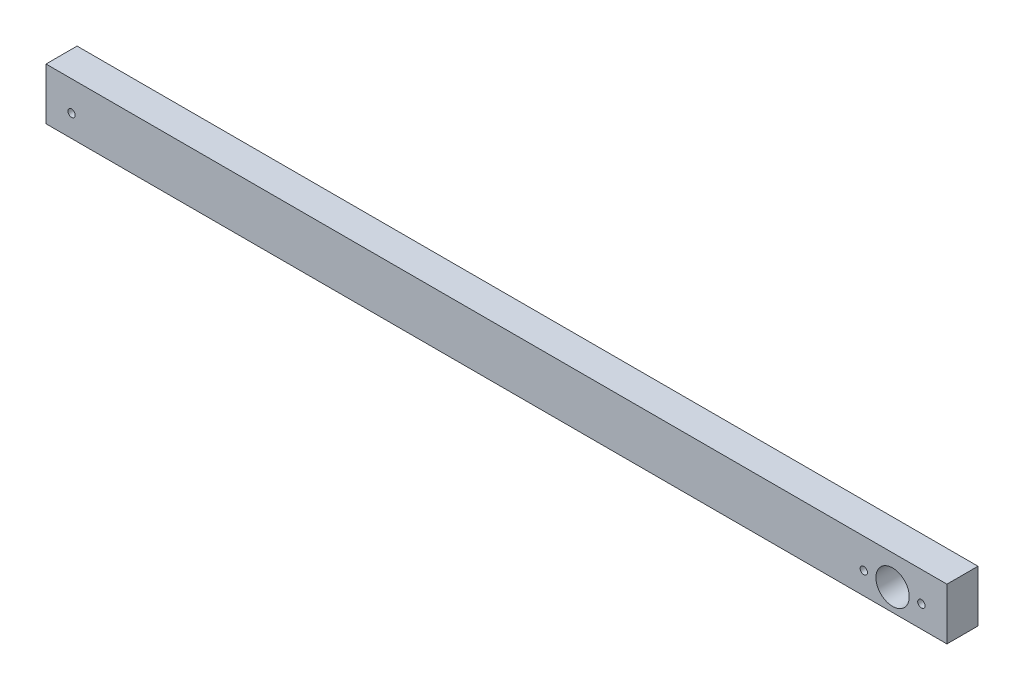
from build123d import *

# Parameters (mm, degrees)
SKETCH1_W                                         = 552.45
SKETCH1_H                                         = 19.05
BOSS_EXTRUDE1_DEPTH                               = 31.75
SKETCH2_R                                         = 10.2235
CUT_EXTRUDE1_DEPTH                                = 279.695560828
CSK_FOR_8_FLAT_HEAD_SOCKET_CAP_SCREW1_D           = 4.4958
CSK_FOR_8_FLAT_HEAD_SOCKET_CAP_SCREW1_CSINK_D     = 9.1186
CSK_FOR_8_FLAT_HEAD_SOCKET_CAP_SCREW1_CSINK_ANGLE = 82
CSK_FOR_8_FLAT_HEAD_MACHINE_SCREW1_D              = 4.4958
CSK_FOR_8_FLAT_HEAD_MACHINE_SCREW1_CSINK_D        = 8.4328
CSK_FOR_8_FLAT_HEAD_MACHINE_SCREW1_CSINK_ANGLE    = 82


with BuildPart() as part:
    # Sketch1 → Boss-Extrude1 (new body)
    with BuildSketch(Plane(origin=(0, 0, 0), x_dir=(1, 0, 0), z_dir=(0, 1, 0))):
        Rectangle(SKETCH1_W, SKETCH1_H)
    extrude(amount=BOSS_EXTRUDE1_DEPTH)

    # Sketch2 → Cut-Extrude1 (cut, through all)
    with BuildSketch(Plane(origin=(0, 0, -9.525), x_dir=(-1, 0, 0), z_dir=(0, 0, -1))):
        with Locations((-242.8875, 13.49375)):
            Circle(SKETCH2_R)
    extrude(amount=-CUT_EXTRUDE1_DEPTH, mode=Mode.SUBTRACT)

    # CSK for #8 Flat Head Socket Cap Screw1 (through all)
    with Locations(Plane(origin=(0, 0, -9.525), x_dir=(1, 0, 0), z_dir=(0, 0, -1))):
        with Locations((260.54685, -13.49375), (225.22815, -13.49375)):
            CounterSinkHole(CSK_FOR_8_FLAT_HEAD_SOCKET_CAP_SCREW1_D / 2, CSK_FOR_8_FLAT_HEAD_SOCKET_CAP_SCREW1_CSINK_D / 2, counter_sink_angle=CSK_FOR_8_FLAT_HEAD_SOCKET_CAP_SCREW1_CSINK_ANGLE)

    # CSK for #8 Flat Head Machine Screw1 (through all)
    with Locations(Plane(origin=(0, 0, -9.525), x_dir=(-1, 0, 0), z_dir=(0, 0, -1))):
        with Locations((260.54685, 13.49375)):
            CounterSinkHole(CSK_FOR_8_FLAT_HEAD_MACHINE_SCREW1_D / 2, CSK_FOR_8_FLAT_HEAD_MACHINE_SCREW1_CSINK_D / 2, counter_sink_angle=CSK_FOR_8_FLAT_HEAD_MACHINE_SCREW1_CSINK_ANGLE)


solid = part.part
